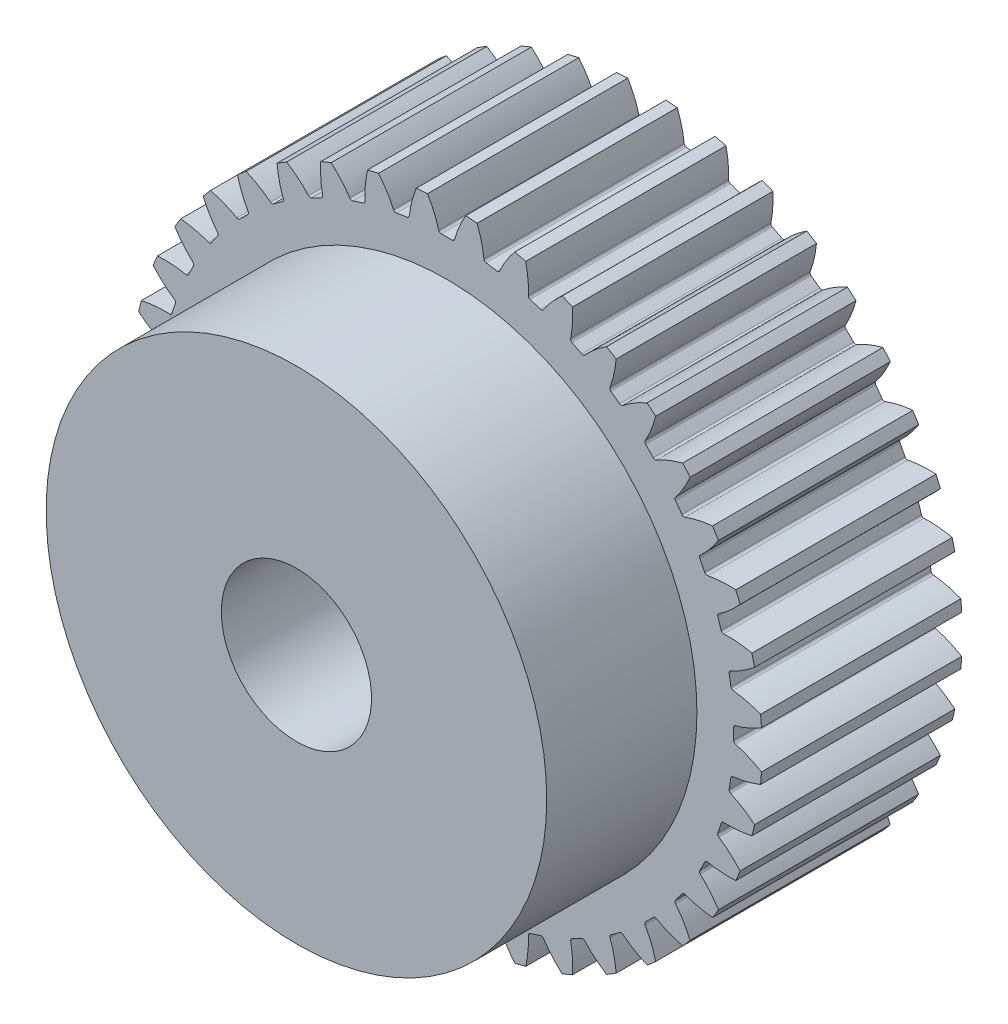
from build123d import *

# Parameters (mm, degrees)
SKETCH1_R                = 31.5
BOSS_EXTRUDE1_DEPTH      = 20
CUT_EXTRUDE2_DEPTH       = 49.831342394
FILLET1_R                = 0.25
CIRPATTERN1_COUNT        = 40
FILLET1_OF_CIRPATTERN1_R = 0.25
SKETCH1_8_R              = 25
BOSS_EXTRUDE2_DEPTH      = 35
SKETCH2_R                = 7.5
CUT_EXTRUDE4_DEPTH       = 57.588251431


with BuildPart() as part:
    # Sketch1 → Boss-Extrude1 (new body)
    with BuildSketch(Plane.XY):
        Circle(SKETCH1_R)
    extrude(amount=BOSS_EXTRUDE1_DEPTH)

    # Sketch1<5> → Cut-Extrude2 (cut, through all)
    with BuildSketch(Plane.XY):
        with BuildLine():
            add(Edge.make_bspline(
                [(-1.906543024, 31.442250137), (-1.695696445, 31.078842528), (-1.308431171, 30.336664954), (-0.941741922, 29.392730706), (-0.785074835, 28.820981083), (-0.748482141, 28.649753144)],
                knots=[0.31361624, 0.31361624, 0.31361624, 0.31361624, 0.385710722, 0.457140092, 0.487211711, 0.487211711, 0.487211711, 0.487211711], degree=3))
            ThreePointArc((-0.748482141, 28.649753144), (0, 28.65952862), (0.748482141, 28.649753144))
            add(Edge.make_bspline(
                [(1.906543024, 31.442250137), (1.695696445, 31.078842528), (1.308431171, 30.336664954), (0.941741922, 29.392730706), (0.785074835, 28.820981083), (0.748482141, 28.649753144)],
                knots=[0.31361624, 0.31361624, 0.31361624, 0.31361624, 0.385710722, 0.457140092, 0.487211711, 0.487211711, 0.487211711, 0.487211711], degree=3))
            ThreePointArc((1.906543024, 31.442250137), (0, 31.5), (-1.906543024, 31.442250137))
        make_face()
    cut_extrude2 = extrude(amount=CUT_EXTRUDE2_DEPTH, mode=Mode.SUBTRACT)

    # Fillet1
    fillet1_edges = [part.edges().sort_by_distance(p)[0] for p in [
        (0.748482141, 28.649753144, 10),
        (-0.748482141, 28.649753144, 10),
    ]]
    fillet(fillet1_edges, radius=FILLET1_R)

    # CirPattern1: Cut-Extrude2 ×40 about axis
    cirpattern1_axis = Axis((0, 0, 20), (0, 0, -1))
    for i in range(1, CIRPATTERN1_COUNT):
        add(cut_extrude2.rotate(cirpattern1_axis, i * 360 / CIRPATTERN1_COUNT), mode=Mode.SUBTRACT)

    # Fillet1 of CirPattern1
    fillet1_of_cirpattern1_edges = [part.edges().sort_by_distance(p)[0] for p in [
        (5.22107589, 28.179938738, 10),
        (3.742541723, 28.414115544, 10),
        (9.565109423, 27.016240716, 10),
        (8.141411789, 27.478828119, 10),
        (13.673618218, 25.187313187, 10),
        (12.339813277, 25.866920749, 10),
        (17.445437151, 22.738190414, 10),
        (16.234367608, 23.618083942, 10),
        (20.787691525, 19.72917793, 10),
        (19.72917793, 20.787691525, 10),
        (23.618083942, 16.234367608, 10),
        (22.738190414, 17.445437151, 10),
        (25.866920749, 12.339813277, 10),
        (25.187313187, 13.673618218, 10),
        (27.478828119, 8.141411789, 10),
        (27.016240716, 9.565109423, 10),
        (28.414115544, 3.742541723, 10),
        (28.179938738, 5.22107589, 10),
        (28.649753144, -0.748482141, 10),
        (28.649753144, 0.748482141, 10),
        (28.179938738, -5.22107589, 10),
        (28.414115544, -3.742541723, 10),
        (27.016240716, -9.565109423, 10),
        (27.478828119, -8.141411789, 10),
        (25.187313187, -13.673618218, 10),
        (25.866920749, -12.339813277, 10),
        (22.738190414, -17.445437151, 10),
        (23.618083942, -16.234367608, 10),
        (19.72917793, -20.787691525, 10),
        (20.787691525, -19.72917793, 10),
        (16.234367608, -23.618083942, 10),
        (17.445437151, -22.738190414, 10),
        (12.339813277, -25.866920749, 10),
        (13.673618218, -25.187313187, 10),
        (8.141411789, -27.478828119, 10),
        (9.565109423, -27.016240716, 10),
        (3.742541723, -28.414115544, 10),
        (5.22107589, -28.179938738, 10),
        (-0.748482141, -28.649753144, 10),
        (0.748482141, -28.649753144, 10),
        (-5.22107589, -28.179938738, 10),
        (-3.742541723, -28.414115544, 10),
        (-9.565109423, -27.016240716, 10),
        (-8.141411789, -27.478828119, 10),
        (-13.673618218, -25.187313187, 10),
        (-12.339813277, -25.866920749, 10),
        (-17.445437151, -22.738190414, 10),
        (-16.234367608, -23.618083942, 10),
        (-20.787691525, -19.72917793, 10),
        (-19.72917793, -20.787691525, 10),
        (-23.618083942, -16.234367608, 10),
        (-22.738190414, -17.445437151, 10),
        (-25.866920749, -12.339813277, 10),
        (-25.187313187, -13.673618218, 10),
        (-27.478828119, -8.141411789, 10),
        (-27.016240716, -9.565109423, 10),
        (-28.414115544, -3.742541723, 10),
        (-28.179938738, -5.22107589, 10),
        (-28.649753144, 0.748482141, 10),
        (-28.649753144, -0.748482141, 10),
        (-28.179938738, 5.22107589, 10),
        (-28.414115544, 3.742541723, 10),
        (-27.016240716, 9.565109423, 10),
        (-27.478828119, 8.141411789, 10),
        (-25.187313187, 13.673618218, 10),
        (-25.866920749, 12.339813277, 10),
        (-22.738190414, 17.445437151, 10),
        (-23.618083942, 16.234367608, 10),
        (-19.72917793, 20.787691525, 10),
        (-20.787691525, 19.72917793, 10),
        (-16.234367608, 23.618083942, 10),
        (-17.445437151, 22.738190414, 10),
        (-12.339813277, 25.866920749, 10),
        (-13.673618218, 25.187313187, 10),
        (-8.141411789, 27.478828119, 10),
        (-9.565109423, 27.016240716, 10),
        (-3.742541723, 28.414115544, 10),
        (-5.22107589, 28.179938738, 10),
    ]]
    fillet(fillet1_of_cirpattern1_edges, radius=FILLET1_OF_CIRPATTERN1_R)

    # Sketch1<8> → Boss-Extrude2 (add)
    with BuildSketch(Plane.XY):
        Circle(SKETCH1_8_R)
    extrude(amount=BOSS_EXTRUDE2_DEPTH)

    # Sketch2 → Cut-Extrude4 (cut, through all)
    with BuildSketch(Plane(origin=(0, 0, 0), x_dir=(-1, 0, 0), z_dir=(0, 0, -1))):
        Circle(SKETCH2_R)
    extrude(amount=-CUT_EXTRUDE4_DEPTH, mode=Mode.SUBTRACT)


solid = part.part
